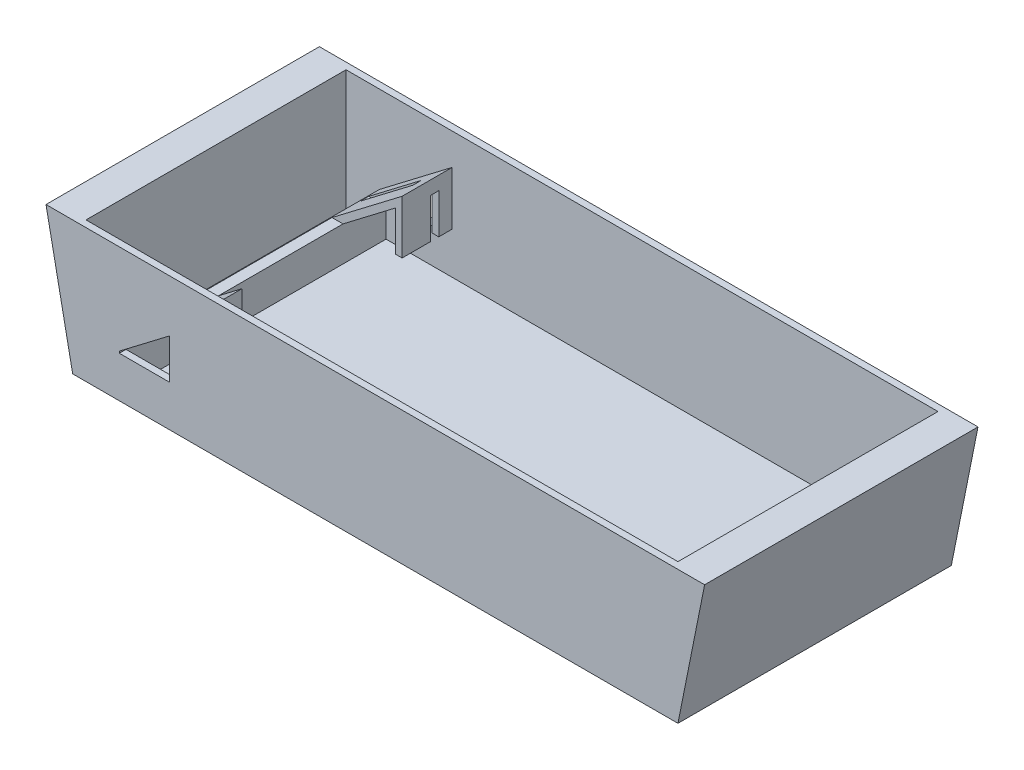
from build123d import *

# Parameters (mm, degrees)
ESQUISSE1_W             = 197.55
ESQUISSE1_H             = 40
BOSS_EXTRU_1_DEPTH      = 82
ESQUISSE2_W             = 177.55
ESQUISSE2_H             = 78
ENL_V_MAT_EXTRU_1_DEPTH = 38
ENL_V_MAT_EXTRU_4_DEPTH = 82
BOSS_EXTRU_6_DEPTH      = 78.5
ESQUISSE8_W             = 48
ESQUISSE8_H             = 16.041036462
ENL_V_MAT_EXTRU_5_DEPTH = 26.4
ESQUISSE9_W             = 2.5
ESQUISSE9_H             = 12.2
ENL_V_MAT_EXTRU_6_DEPTH = 26.4
ESQUISSE10_W            = 2.5
ESQUISSE10_H            = 12
ENL_V_MAT_EXTRU_7_DEPTH = 26.4
ENL_V_MAT_EXTRU_9_DEPTH = 82


with BuildPart() as part:
    # Esquisse1 → Boss.-Extru.1 (new body)
    with BuildSketch(Plane.XY):
        with Locations((-98.775, 20)):
            Rectangle(ESQUISSE1_W, ESQUISSE1_H)
    extrude(amount=BOSS_EXTRU_1_DEPTH)

    # Esquisse2 → Enlèv. mat.-Extru.1 (cut)
    with BuildSketch(Plane(origin=(0, 40, 0), x_dir=(1, 0, 0), z_dir=(0, 1, 0))):
        with Locations((-98.775, -41)):
            Rectangle(ESQUISSE2_W, ESQUISSE2_H)
    extrude(amount=-ENL_V_MAT_EXTRU_1_DEPTH, mode=Mode.SUBTRACT)

    # Esquisse3 → Enlèv. mat.-Extru.4 (cut)
    with BuildSketch(Plane.XY):
        Polygon((-197.55, 40), (-189.55, 0), (-197.55, 0), align=None)
        Polygon((0, 40), (-8, 0), (0, 0), align=None)
    extrude(amount=ENL_V_MAT_EXTRU_4_DEPTH, mode=Mode.SUBTRACT)

    # Esquisse6 → Boss.-Extru.6 (add)
    with BuildSketch(Plane.XY.offset(2)):
        Polygon((-175.55, 12.914570305), (-175.55, 0.914570305), (-177.55, 0.914570305), (-177.55, 13.90441537), (-155.74, 30.541036462), (-155.74, 14.5), (-157.74, 14.5), (-157.74, 26.5), align=None)
    extrude(amount=BOSS_EXTRU_6_DEPTH)

    # Esquisse8 → Enlèv. mat.-Extru.5 (cut)
    with BuildSketch(Plane(origin=(-155.74, 0, 0), x_dir=(0, 0, -1), z_dir=(1, 0, 0))):
        with Locations((-41, 22.520518231)):
            Rectangle(ESQUISSE8_W, ESQUISSE8_H)
    extrude(amount=-ENL_V_MAT_EXTRU_5_DEPTH, mode=Mode.SUBTRACT)

    # Esquisse9 → Enlèv. mat.-Extru.6 (cut)
    with BuildSketch(Plane(origin=(-155.74, 0, 0), x_dir=(0, 0, -1), z_dir=(1, 0, 0))):
        with Locations((-74.75, 20.6)):
            Rectangle(ESQUISSE9_W, ESQUISSE9_H)
    extrude(amount=-ENL_V_MAT_EXTRU_6_DEPTH, mode=Mode.SUBTRACT)

    # Esquisse10 → Enlèv. mat.-Extru.7 (cut)
    with BuildSketch(Plane(origin=(-155.74, 0, 0), x_dir=(0, 0, -1), z_dir=(1, 0, 0))):
        with Locations((-7.25, 20.5)):
            Rectangle(ESQUISSE10_W, ESQUISSE10_H)
    extrude(amount=-ENL_V_MAT_EXTRU_7_DEPTH, mode=Mode.SUBTRACT)

    # Esquisse11 → Enlèv. mat.-Extru.9 (cut)
    with BuildSketch(Plane(origin=(0, 0, 0), x_dir=(-1, 0, 0), z_dir=(0, 0, -1))):
        Polygon((175.55, 12.914570305), (160.55, 24.356538044), (160.55, 12.356538044), (175.55, 12.356538044), align=None)
    extrude(amount=-ENL_V_MAT_EXTRU_9_DEPTH, mode=Mode.SUBTRACT)


solid = part.part
